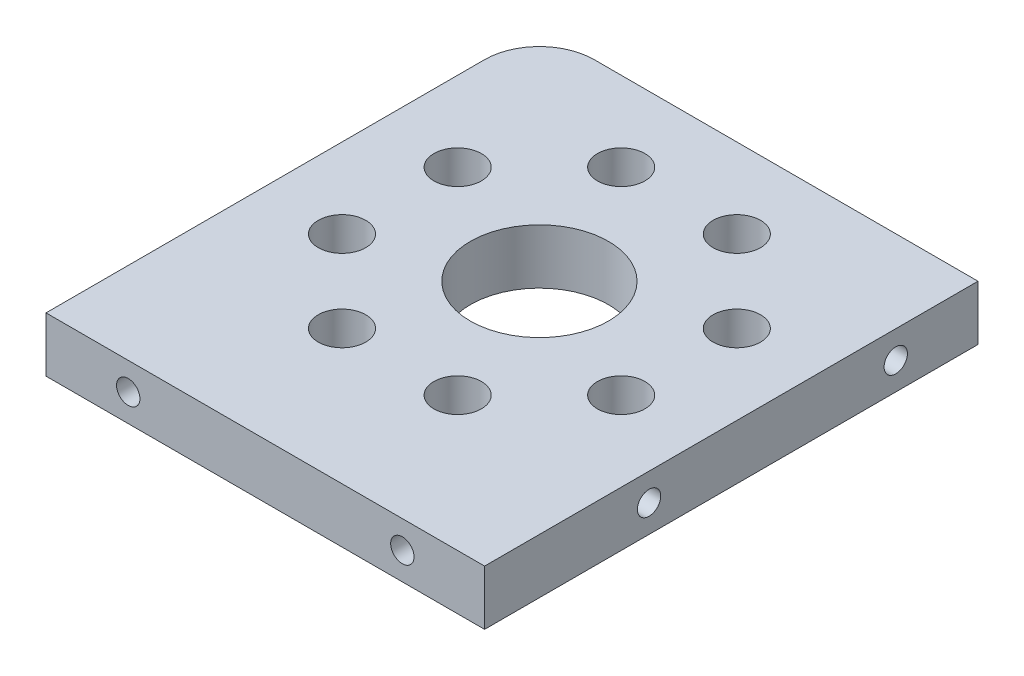
from build123d import *

# Parameters (mm, degrees)
SKETCH1_W                     = 50.8
SKETCH1_H                     = 57.15
BOSS_EXTRUDE1_DEPTH           = 6.35
M5_CLEARANCE_HOLE1_D          = 5.5
M5_CLEARANCE_HOLE1_DEPTH      = 12.7
M5_CLEARANCE_HOLE1_TIP        = 1.652366702
TAP_DRILL_FOR_6_32_TAP1_D     = 2.7051
TAP_DRILL_FOR_6_32_TAP1_DEPTH = 12.7
TAP_DRILL_FOR_6_32_TAP1_TIP   = 0.81269403
TAP_DRILL_FOR_6_32_TAP2_D     = 2.7051
TAP_DRILL_FOR_6_32_TAP2_DEPTH = 12.7
TAP_DRILL_FOR_6_32_TAP2_TIP   = 0.81269403
FILLET1_R                     = 6.35
SKETCH8_R                     = 8
CUT_EXTRUDE1_DEPTH            = 6.35


with BuildPart() as part:
    # Sketch1 → Boss-Extrude1 (new body)
    with BuildSketch(Plane(origin=(0, 0, 0), x_dir=(1, 0, 0), z_dir=(0, 1, 0))):
        Rectangle(SKETCH1_W, SKETCH1_H)
    extrude(amount=BOSS_EXTRUDE1_DEPTH)

    # M5 Clearance Hole1
    with Locations(Plane(origin=(0, 6.35, 0), x_dir=(1, 0, 0), z_dir=(0, 1, 0))):
        with Locations((-16.167891819, 9.871960066), (-6.696960066, -12.992891819), (16.167891819, -3.521960066), (-6.696960066, 19.342891819), (6.696960066, 19.342891819), (16.167891819, 9.871960066), (-16.167891819, -3.521960066), (6.696960066, -12.992891819)):
            Hole(M5_CLEARANCE_HOLE1_D / 2, depth=M5_CLEARANCE_HOLE1_DEPTH)
            with Locations((0, 0, -(M5_CLEARANCE_HOLE1_DEPTH + M5_CLEARANCE_HOLE1_TIP / 2))):  # 118° drill point
                Cone(0, M5_CLEARANCE_HOLE1_D / 2, M5_CLEARANCE_HOLE1_TIP, mode=Mode.SUBTRACT)

    # Tap Drill for #6-32 Tap1
    with Locations(Plane.XY.offset(28.575)):
        with Locations((-15.875, 3.175), (15.875, 3.175)):
            Hole(TAP_DRILL_FOR_6_32_TAP1_D / 2, depth=TAP_DRILL_FOR_6_32_TAP1_DEPTH)
            with Locations((0, 0, -(TAP_DRILL_FOR_6_32_TAP1_DEPTH + TAP_DRILL_FOR_6_32_TAP1_TIP / 2))):  # 118° drill point
                Cone(0, TAP_DRILL_FOR_6_32_TAP1_D / 2, TAP_DRILL_FOR_6_32_TAP1_TIP, mode=Mode.SUBTRACT)

    # Tap Drill for #6-32 Tap2
    with Locations(Plane(origin=(25.4, 0, 0), x_dir=(0, 0, -1), z_dir=(1, 0, 0))):
        with Locations((-9.525, 3.175), (19.05, 3.175)):
            Hole(TAP_DRILL_FOR_6_32_TAP2_D / 2, depth=TAP_DRILL_FOR_6_32_TAP2_DEPTH)
            with Locations((0, 0, -(TAP_DRILL_FOR_6_32_TAP2_DEPTH + TAP_DRILL_FOR_6_32_TAP2_TIP / 2))):  # 118° drill point
                Cone(0, TAP_DRILL_FOR_6_32_TAP2_D / 2, TAP_DRILL_FOR_6_32_TAP2_TIP, mode=Mode.SUBTRACT)

    # Fillet1
    fillet1_edges = [part.edges().sort_by_distance(p)[0] for p in [
        (-25.4, 3.175, -28.575),
    ]]
    fillet(fillet1_edges, radius=FILLET1_R)

    # Sketch8 → Cut-Extrude1 (cut)
    with BuildSketch(Plane(origin=(0, 6.35, 0), x_dir=(1, 0, 0), z_dir=(0, 1, 0))):
        with Locations(Location((0, 3.175, 0), (0, 0, 270))):
            Circle(SKETCH8_R)
    extrude(amount=-CUT_EXTRUDE1_DEPTH, mode=Mode.SUBTRACT)


solid = part.part
